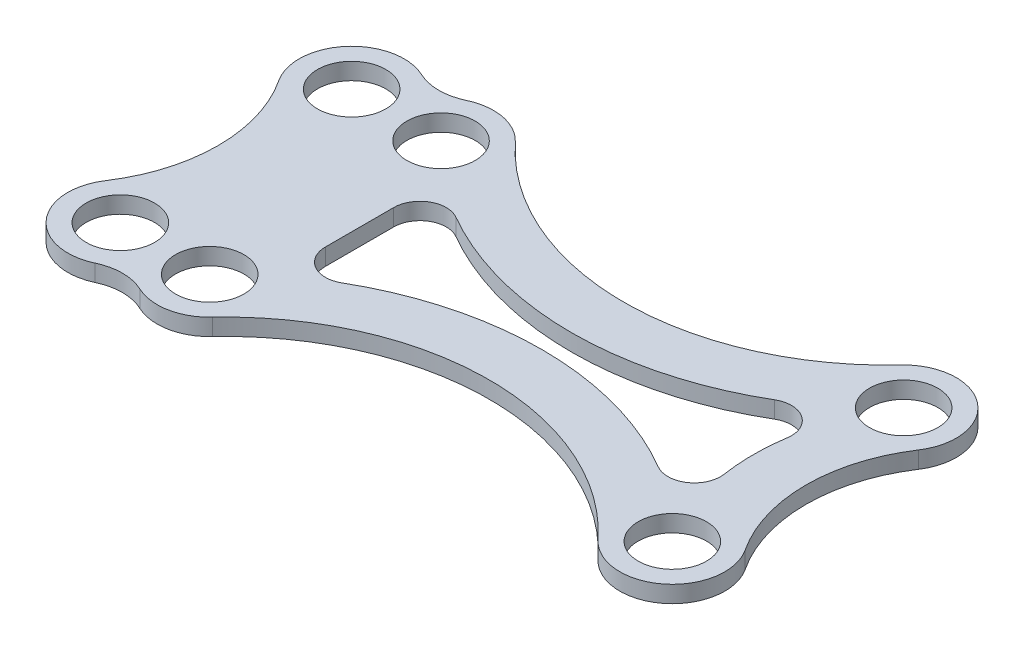
from build123d import *

# Parameters (mm, degrees)
BASE_DEPTH    = 3.2
SKETCH2_R     = 6.5
HOLES_DEPTH   = 120.412059692
CUTAWAY_DEPTH = 120.412059692


with BuildPart() as part:
    # Sketch1 → base (new body)
    with BuildSketch(Plane(origin=(0, 0, 0), x_dir=(1, 0, 0), z_dir=(0, 1, 0))):
        with BuildLine():
            ThreePointArc((4.25, 31.051933495), (-7.559468778, 28.546329643), (-8.351646544, 16.5))
            ThreePointArc((-8.351646544, 16.5), (-3.406586177, 0), (-8.351646544, -16.5))
            ThreePointArc((-8.351646544, -16.5), (-7.559468778, -28.546329643), (4.25, -31.051933495))
            ThreePointArc((4.25, -31.051933495), (8.5, -30.10386699), (12.75, -31.051933495))
            ThreePointArc((12.75, -31.051933495), (18.909452709, -31.816006843), (24.333333333, -28.798692685))
            ThreePointArc((24.333333333, -28.798692685), (61, -12.792156109), (97.666666667, -28.798692685))
            ThreePointArc((97.666666667, -28.798692685), (111.170389039, -29.869326471), (113.351646544, -16.5))
            ThreePointArc((113.351646544, -16.5), (108.406586177, 0), (113.351646544, 16.5))
            ThreePointArc((113.351646544, 16.5), (111.170389039, 29.869326471), (97.666666667, 28.798692685))
            ThreePointArc((97.666666667, 28.798692685), (61, 12.792156109), (24.333333333, 28.798692685))
            ThreePointArc((24.333333333, 28.798692685), (18.909452709, 31.816006843), (12.75, 31.051933495))
            ThreePointArc((12.75, 31.051933495), (8.5, 30.10386699), (4.25, 31.051933495))
        make_face()
    extrude(amount=-BASE_DEPTH)

    # Sketch2 → holes (cut, through all)
    with BuildSketch(Plane(origin=(0, 0, 0), x_dir=(1, 0, 0), z_dir=(0, 1, 0))):
        with Locations(Location((0, 22, 0), (0, 0, 270))):
            Circle(SKETCH2_R)
        with Locations(Location((17, 22, 0), (0, 0, 270))):
            Circle(SKETCH2_R)
        with Locations(Location((105, 22, 0), (0, 0, 270))):
            Circle(SKETCH2_R)
        with Locations(Location((105, -22, 0), (0, 0, 270))):
            Circle(SKETCH2_R)
        with Locations(Location((17, -22, 0), (0, 0, 270))):
            Circle(SKETCH2_R)
        with Locations(Location((0, -22, 0), (0, 0, 270))):
            Circle(SKETCH2_R)
    extrude(amount=-HOLES_DEPTH, mode=Mode.SUBTRACT)

    # Sketch3 → cutaway (cut, through all)
    with BuildSketch(Plane(origin=(0, 0, 0), x_dir=(-1, 0, 0), z_dir=(0, 1, 0))):
        with BuildLine():
            Line((-23.5, -6.500504863), (-23.5, 6.500504863))
            ThreePointArc((-23.5, 6.500504863), (-26, 10.830631882), (-31, 10.830631882))
            ThreePointArc((-31, 10.830631882), (-61.221365673, 2.792564466), (-91.38259727, 11.053410636))
            ThreePointArc((-91.38259727, 11.053410636), (-96.717445945, 10.882305495), (-98.858047687, 5.992754234))
            ThreePointArc((-98.858047687, 5.992754234), (-98.406586177, 0), (-98.858047687, -5.992754234))
            ThreePointArc((-98.858047687, -5.992754234), (-96.717445945, -10.882305495), (-91.38259727, -11.053410636))
            ThreePointArc((-91.38259727, -11.053410636), (-61.221365673, -2.792564466), (-31, -10.830631882))
            ThreePointArc((-31, -10.830631882), (-26, -10.830631882), (-23.5, -6.500504863))
        make_face()
    extrude(amount=-CUTAWAY_DEPTH, mode=Mode.SUBTRACT)


solid = part.part
